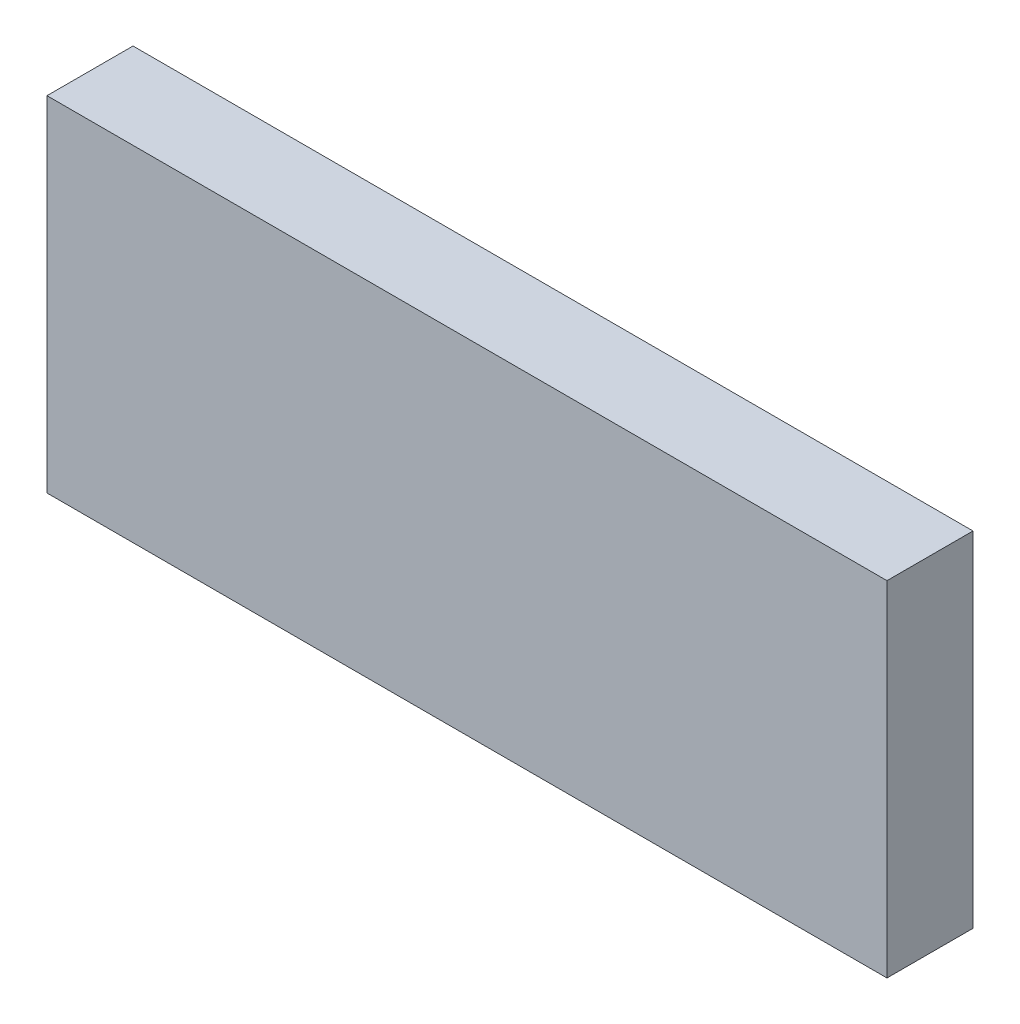
from build123d import *

# Parameters (mm, degrees)
ESBO_O1_W                = 62
ESBO_O1_H                = 25.4
RESSALTO_EXTRUS_O1_DEPTH = 6.35


with BuildPart() as part:
    # Esboço1 → Ressalto-extrusão1 (new body)
    with BuildSketch(Plane.XY):
        with Locations((31, 12.7)):
            Rectangle(ESBO_O1_W, ESBO_O1_H)
    extrude(amount=RESSALTO_EXTRUS_O1_DEPTH)


solid = part.part
